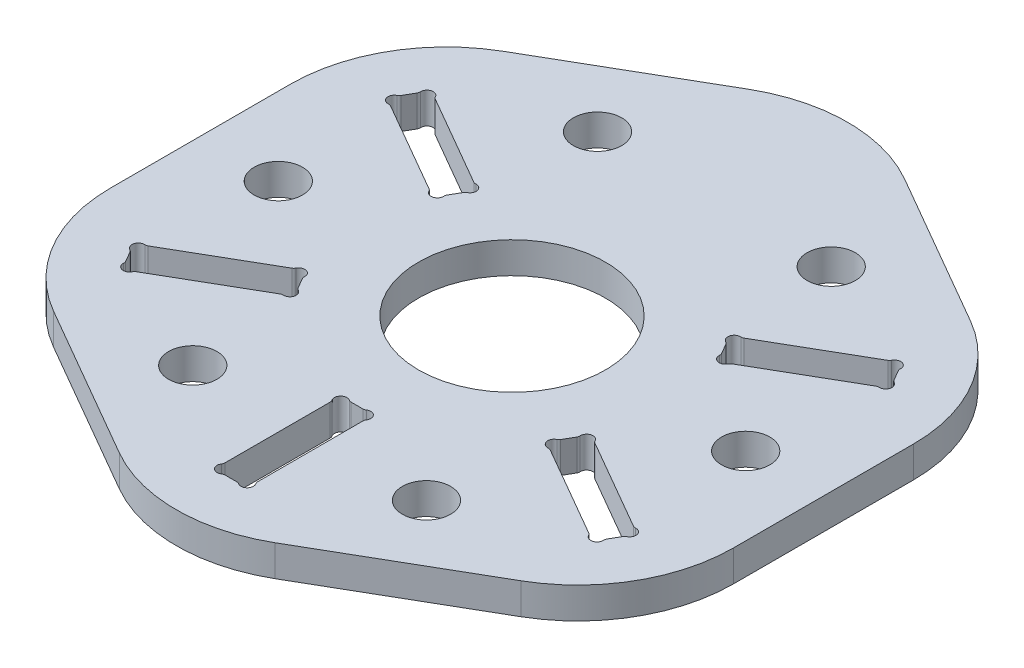
from build123d import *

# Parameters (mm, degrees)
EXTRUDE_1_DEPTH          = 2
SKETCH_1_3_W             = 2.1
SKETCH_1_3_H             = 8.1
CUT_EXTRUDE_1_DEPTH      = 31.615900009
SKETCH_2_R               = 1.55
SKETCH_2_R_2             = 6
CUT_EXTRUDE_2_DEPTH      = 10
FILLET_1_R               = 10
SKETCH_4_R               = 0.4
CUT_EXTRUDE_3_DEPTH      = 10
PATTERN_CIRCULAR_1_COUNT = 5
PATTERN_CIRCULAR_1_ANGLE = 240
FILLET_2_R               = 0.3


with BuildPart() as part:
    # 草图1 → 凸台-拉伸1 (new body)
    with BuildSketch(Plane(origin=(0, 0, 0), x_dir=(1, 0, 0), z_dir=(0, 1, 0))):
        Polygon((20, -11.547005384), (20, 11.547005384), (0, 23.094010768), (-20, 11.547005384), (-20, -11.547005384), (0, -23.094010768), align=None)
    extrude(amount=EXTRUDE_1_DEPTH)

    # 草图1<3> → 切除-拉伸1 (cut, through all)
    with BuildSketch(Plane(origin=(0, 0, 0), x_dir=(1, 0, 0), z_dir=(0, 1, 0))):
        Polygon((8.091952768, -5.884326674), (15.106758538, -9.934326674), (16.156758538, -8.115673326), (9.141952768, -4.065673326), align=None)
        with Locations((0, -14)):
            Rectangle(SKETCH_1_3_W, SKETCH_1_3_H)
        Polygon((-8.091952768, -5.884326674), (-15.106758538, -9.934326674), (-16.156758538, -8.115673326), (-9.141952768, -4.065673326), align=None)
        Polygon((-9.141952768, 4.065673326), (-16.156758538, 8.115673326), (-15.106758538, 9.934326674), (-8.091952768, 5.884326674), align=None)
        Polygon((8.091952768, 5.884326674), (15.106758538, 9.934326674), (16.156758538, 8.115673326), (9.141952768, 4.065673326), align=None)
    extrude(amount=CUT_EXTRUDE_1_DEPTH, mode=Mode.SUBTRACT)

    # 草图2 → 切除-拉伸2 (cut)
    with BuildSketch(Plane(origin=(0, 2, 0), x_dir=(1, 0, 0), z_dir=(0, 1, 0))):
        with Locations(Location((15, 0, 0), (0, 0, 270))):
            Circle(SKETCH_2_R)
        with Locations(Location((0, 0, 0), (0, 0, 270))):
            Circle(SKETCH_2_R_2)
        with Locations(Location((7.5, -12.990381057, 0), (0, 0, 270))):
            Circle(SKETCH_2_R)
        with Locations(Location((-7.5, -12.990381057, 0), (0, 0, 270))):
            Circle(SKETCH_2_R)
        with Locations(Location((-15, 0, 0), (0, 0, 270))):
            Circle(SKETCH_2_R)
        with Locations(Location((-7.5, 12.990381057, 0), (0, 0, 270))):
            Circle(SKETCH_2_R)
        with Locations(Location((7.5, 12.990381057, 0), (0, 0, 270))):
            Circle(SKETCH_2_R)
    extrude(amount=-CUT_EXTRUDE_2_DEPTH, mode=Mode.SUBTRACT)

    # 圆角1
    fillet_1_edges = [part.edges().sort_by_distance(p)[0] for p in [
        (20, 1, -11.547005384),
        (20, 1, 11.547005384),
        (0, 1, 23.094010768),
        (-20, 1, 11.547005384),
        (-20, 1, -11.547005384),
        (0, 1, -23.094010768),
    ]]
    fillet(fillet_1_edges, radius=FILLET_1_R)

    # 草图4 → 切除-拉伸3 (cut)
    with BuildSketch(Plane(origin=(0, 2, 0), x_dir=(1, 0, 0), z_dir=(0, 1, 0))):
        with Locations((15.00323092, 9.547956343)):
            Circle(SKETCH_4_R)
        with Locations((15.770388208, 8.219200944)):
            Circle(SKETCH_4_R)
        with Locations((8.478323098, 5.780799056)):
            Circle(SKETCH_4_R)
        with Locations((9.245480386, 4.452043657)):
            Circle(SKETCH_4_R)
    cut_extrude_3 = extrude(amount=-CUT_EXTRUDE_3_DEPTH, mode=Mode.SUBTRACT)

    # 阵列(圆周)1: 切除-拉伸3 ×5 about axis
    pattern_circular_1_axis = Axis((0, 0, 0), (0, -1, 0))
    for i in range(1, PATTERN_CIRCULAR_1_COUNT):
        add(cut_extrude_3.rotate(pattern_circular_1_axis, i * PATTERN_CIRCULAR_1_ANGLE / (PATTERN_CIRCULAR_1_COUNT - 1)), mode=Mode.SUBTRACT)

    # 圆角2
    fillet_2_edges = [part.edges().sort_by_distance(p)[0] for p in [
        (8.37479548, 1, -5.394428725),
        (8.859110055, 1, -4.555571275),
        (14.61686059, 1, -9.651483961),
        (15.873915826, 1, -8.605571275),
        (15.389601251, 1, -9.444428725),
        (15.66686059, 1, -7.832830614),
        (9.631850716, 1, -4.348516039),
        (8.581850716, 1, -6.167169386),
        (-8.859110055, 1, -4.555571275),
        (-8.37479548, 1, -5.394428725),
        (-15.66686059, 1, -7.832830614),
        (-15.389601251, 1, -9.444428725),
        (-8.859110055, 1, 4.555571275),
        (-8.37479548, 1, 5.394428725),
        (-14.61686059, 1, 9.651483961),
        (-15.873915826, 1, 8.605571275),
        (-0.484314575, 1, 9.95),
        (0.484314575, 1, 9.95),
        (1.05, 1, 17.484314575),
        (-0.484314575, 1, 18.05),
        (15.873915826, 1, 8.605571275),
        (15.389601251, 1, 9.444428725),
        (8.581850716, 1, 6.167169386),
        (8.859110055, 1, 4.555571275),
        (-14.61686059, 1, -9.651483961),
        (-15.873915826, 1, -8.605571275),
        (14.61686059, 1, 9.651483961),
        (15.66686059, 1, 7.832830614),
        (8.37479548, 1, 5.394428725),
        (1.05, 1, 10.515685425),
        (-1.05, 1, 10.515685425),
        (0.484314575, 1, 18.05),
        (-8.581850716, 1, -6.167169386),
        (-9.631850716, 1, -4.348516039),
        (-15.66686059, 1, 7.832830614),
        (-1.05, 1, 17.484314575),
        (-8.581850716, 1, 6.167169386),
        (-9.631850716, 1, 4.348516039),
        (-15.389601251, 1, 9.444428725),
        (9.631850716, 1, 4.348516039),
    ]]
    fillet(fillet_2_edges, radius=FILLET_2_R)


solid = part.part
